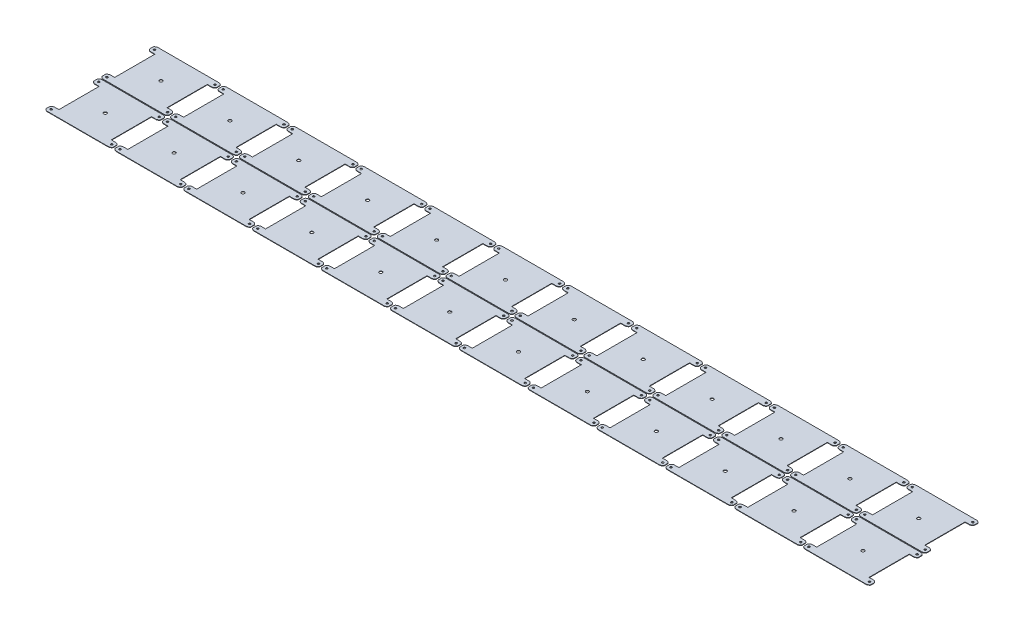
from build123d import *

# Parameters (mm, degrees)
SKETCH1_R               = 2
SKETCH1_R_2             = 3.175
BOSS_EXTRUDE1_DEPTH     = 0.86
CUT_EXTRUDE1_DEPTH      = 10
CUT_EXTRUDE1_DEPTH_BACK = 10
SKETCH2_W               = 142
SKETCH2_H               = 117
SKETCH2_W_2             = 138
SKETCH2_H_2             = 115
LPATTERN2_COUNT         = 2
LPATTERN2_PITCH         = 115
LPATTERN2_2_COUNT       = 12
LPATTERN2_2_PITCH       = 142


with BuildPart() as part:
    # Sketch1 → Boss-Extrude1 (new body)
    with BuildSketch(Plane(origin=(0, 0, 0), x_dir=(1, 0, 0), z_dir=(0, 1, 0))):
        with BuildLine():
            Line((-62.5, 56.5), (62.5, 56.5))
            ThreePointArc((62.5, 56.5), (70, 49), (62.5, 41.5))
            Line((62.5, 41.5), (54, 41.5))
            Line((54, 41.5), (54, -41.5))
            Line((54, -41.5), (62.5, -41.5))
            ThreePointArc((62.5, -41.5), (70, -49), (62.5, -56.5))
            Line((62.5, -56.5), (-62.5, -56.5))
            ThreePointArc((-62.5, -56.5), (-70, -49), (-62.5, -41.5))
            Line((-62.5, -41.5), (-54, -41.5))
            Line((-54, -41.5), (-54, 41.5))
            Line((-54, 41.5), (-62.5, 41.5))
            ThreePointArc((-62.5, 41.5), (-70, 49), (-62.5, 56.5))
        make_face()
        with Locations(Location((-62.5, 49, 0), (0, 0, 270))):
            Circle(SKETCH1_R, mode=Mode.SUBTRACT)
        with Locations(Location((62.5, 49, 0), (0, 0, 270))):
            Circle(SKETCH1_R, mode=Mode.SUBTRACT)
        with Locations(Location((62.5, -49, 0), (0, 0, 270))):
            Circle(SKETCH1_R, mode=Mode.SUBTRACT)
        with Locations(Location((-62.5, -49, 0), (0, 0, 270))):
            Circle(SKETCH1_R, mode=Mode.SUBTRACT)
        with Locations(Location((0, 0, 0), (0, 0, 270))):
            Circle(SKETCH1_R_2, mode=Mode.SUBTRACT)
    extrude(amount=BOSS_EXTRUDE1_DEPTH)

    # Sketch2 → Cut-Extrude1 (cut, two sides: drawn at the far end of the back side and taken through both)
    with BuildSketch(Plane(origin=(0, 0, 0), x_dir=(1, 0, 0), z_dir=(0, 1, 0)).offset(-CUT_EXTRUDE1_DEPTH_BACK)):
        Rectangle(SKETCH2_W, SKETCH2_H)
        Rectangle(SKETCH2_W_2, SKETCH2_H_2, mode=Mode.SUBTRACT)
    extrude(amount=CUT_EXTRUDE1_DEPTH + CUT_EXTRUDE1_DEPTH_BACK, mode=Mode.SUBTRACT)


with BuildPart() as lpattern2_1:
    # LPattern2: pattern copy
    add(part.part.moved(Location(Vector(0, 0, -1) * (1 * LPATTERN2_PITCH))))


with BuildPart() as lpattern2_2_1:
    # LPattern2 2: pattern copy
    add(part.part.moved(Location(Vector(1, 0, 0) * (1 * LPATTERN2_2_PITCH))))


with BuildPart() as lpattern2_2_2:
    # LPattern2 2: pattern copy
    add(part.part.moved(Location(Vector(1, 0, 0) * (2 * LPATTERN2_2_PITCH))))


with BuildPart() as lpattern2_2_3:
    # LPattern2 2: pattern copy
    add(part.part.moved(Location(Vector(1, 0, 0) * (3 * LPATTERN2_2_PITCH))))


with BuildPart() as lpattern2_2_4:
    # LPattern2 2: pattern copy
    add(part.part.moved(Location(Vector(1, 0, 0) * (4 * LPATTERN2_2_PITCH))))


with BuildPart() as lpattern2_2_5:
    # LPattern2 2: pattern copy
    add(part.part.moved(Location(Vector(1, 0, 0) * (5 * LPATTERN2_2_PITCH))))


with BuildPart() as lpattern2_2_6:
    # LPattern2 2: pattern copy
    add(part.part.moved(Location(Vector(1, 0, 0) * (6 * LPATTERN2_2_PITCH))))


with BuildPart() as lpattern2_2_7:
    # LPattern2 2: pattern copy
    add(part.part.moved(Location(Vector(1, 0, 0) * (7 * LPATTERN2_2_PITCH))))


with BuildPart() as lpattern2_2_8:
    # LPattern2 2: pattern copy
    add(part.part.moved(Location(Vector(1, 0, 0) * (8 * LPATTERN2_2_PITCH))))


with BuildPart() as lpattern2_2_9:
    # LPattern2 2: pattern copy
    add(part.part.moved(Location(Vector(1, 0, 0) * (9 * LPATTERN2_2_PITCH))))


with BuildPart() as lpattern2_2_10:
    # LPattern2 2: pattern copy
    add(part.part.moved(Location(Vector(1, 0, 0) * (10 * LPATTERN2_2_PITCH))))


with BuildPart() as lpattern2_2_11:
    # LPattern2 2: pattern copy
    add(part.part.moved(Location(Vector(1, 0, 0) * (11 * LPATTERN2_2_PITCH))))


with BuildPart() as lpattern2_2_12:
    # LPattern2 2: pattern copy
    add(lpattern2_1.part.moved(Location(Vector(1, 0, 0) * (1 * LPATTERN2_2_PITCH))))


with BuildPart() as lpattern2_2_13:
    # LPattern2 2: pattern copy
    add(lpattern2_1.part.moved(Location(Vector(1, 0, 0) * (2 * LPATTERN2_2_PITCH))))


with BuildPart() as lpattern2_2_14:
    # LPattern2 2: pattern copy
    add(lpattern2_1.part.moved(Location(Vector(1, 0, 0) * (3 * LPATTERN2_2_PITCH))))


with BuildPart() as lpattern2_2_15:
    # LPattern2 2: pattern copy
    add(lpattern2_1.part.moved(Location(Vector(1, 0, 0) * (4 * LPATTERN2_2_PITCH))))


with BuildPart() as lpattern2_2_16:
    # LPattern2 2: pattern copy
    add(lpattern2_1.part.moved(Location(Vector(1, 0, 0) * (5 * LPATTERN2_2_PITCH))))


with BuildPart() as lpattern2_2_17:
    # LPattern2 2: pattern copy
    add(lpattern2_1.part.moved(Location(Vector(1, 0, 0) * (6 * LPATTERN2_2_PITCH))))


with BuildPart() as lpattern2_2_18:
    # LPattern2 2: pattern copy
    add(lpattern2_1.part.moved(Location(Vector(1, 0, 0) * (7 * LPATTERN2_2_PITCH))))


with BuildPart() as lpattern2_2_19:
    # LPattern2 2: pattern copy
    add(lpattern2_1.part.moved(Location(Vector(1, 0, 0) * (8 * LPATTERN2_2_PITCH))))


with BuildPart() as lpattern2_2_20:
    # LPattern2 2: pattern copy
    add(lpattern2_1.part.moved(Location(Vector(1, 0, 0) * (9 * LPATTERN2_2_PITCH))))


with BuildPart() as lpattern2_2_21:
    # LPattern2 2: pattern copy
    add(lpattern2_1.part.moved(Location(Vector(1, 0, 0) * (10 * LPATTERN2_2_PITCH))))


with BuildPart() as lpattern2_2_22:
    # LPattern2 2: pattern copy
    add(lpattern2_1.part.moved(Location(Vector(1, 0, 0) * (11 * LPATTERN2_2_PITCH))))


solid = Compound([part.part, lpattern2_1.part, lpattern2_2_1.part, lpattern2_2_2.part, lpattern2_2_3.part, lpattern2_2_4.part, lpattern2_2_5.part, lpattern2_2_6.part, lpattern2_2_7.part, lpattern2_2_8.part, lpattern2_2_9.part, lpattern2_2_10.part, lpattern2_2_11.part, lpattern2_2_12.part, lpattern2_2_13.part, lpattern2_2_14.part, lpattern2_2_15.part, lpattern2_2_16.part, lpattern2_2_17.part, lpattern2_2_18.part, lpattern2_2_19.part, lpattern2_2_20.part, lpattern2_2_21.part, lpattern2_2_22.part])
